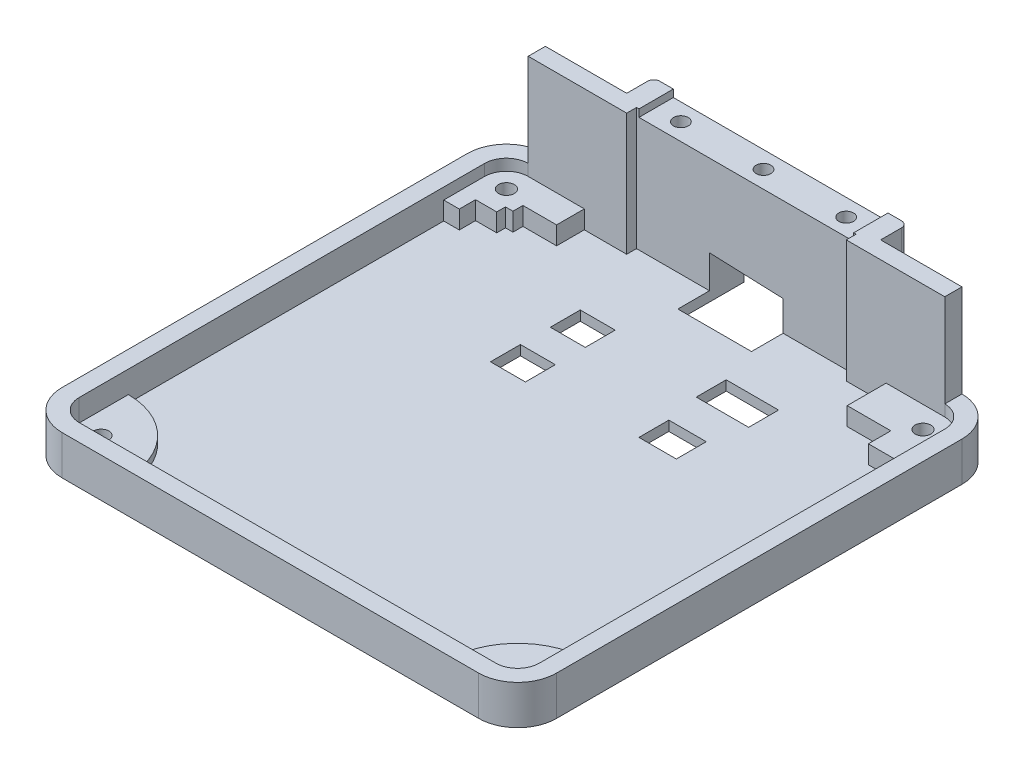
from build123d import *
from build123d.topology import SkipClean

# Parameters (mm, degrees)
SKETCH2_R             = 1.6
BOSS_EXTRUDE1_DEPTH   = 1.5
BOSS_EXTRUDE1_2_DEPTH = 1.5
BOSS_EXTRUDE3_START   = 2
SKETCH5_R             = 1.6
SKETCH5_W             = 7.112
SKETCH5_H             = 6.096
SKETCH5_W_2           = 7.62
BOSS_EXTRUDE3_DEPTH   = 2
SKETCH6_R             = 1.6
BOSS_EXTRUDE4_DEPTH   = 3.7
SKETCH7_W             = 15
SKETCH7_H             = 3.5
CUT_EXTRUDE1_DEPTH    = 18.7
BOSS_EXTRUDE5_DEPTH   = 14
SKETCH10_W            = 8.676175164
SKETCH10_H            = 12.620836119
BOSS_EXTRUDE6_DEPTH   = 20.2
BOSS_EXTRUDE9_START   = -25.9
BOSS_EXTRUDE9_DEPTH   = 25.9
BOSS_EXTRUDE10_DEPTH  = 9.9
SKETCH17_W            = 44.717081264
SKETCH17_H            = 2
CUT_EXTRUDE3_DEPTH    = 23.9
SKETCH18_W            = 4.640484925
SKETCH18_H            = 8.524085484
BOSS_EXTRUDE11_DEPTH  = 19.7
CUT_EXTRUDE4_DEPTH    = 0.5
BOSS_EXTRUDE12_START  = 1.5
BOSS_EXTRUDE12_DEPTH  = 1.5
SKETCH22_R            = 1.5
CUT_EXTRUDE5_DEPTH    = 8
BOSS_EXTRUDE13_START  = 5
SKETCH24_R            = 1.5
SKETCH24_R_2          = 0.75
BOSS_EXTRUDE13_DEPTH  = 5
SKETCH25_W            = 4.640484925
SKETCH25_H            = 19.7
CUT_EXTRUDE6_DEPTH    = 8.524085484
SKETCH26_W            = 8.676175164
SKETCH26_H            = 12.620836119
CUT_EXTRUDE7_DEPTH    = 23.9
CUT_EXTRUDE12_DEPTH   = 38
CUT_EXTRUDE13_START   = -8
CUT_EXTRUDE13_DEPTH   = 8


with BuildPart() as part:
    # Sketch2 → Boss-Extrude1 (new body)
    with BuildSketch(Plane(origin=(0, 0, 0), x_dir=(1, 0, 0), z_dir=(0, 1, 0))):
        with BuildLine():
            ThreePointArc((46.858540632, -31.275), (36.647536427, -35.504536427), (32.418, -45.715540632))
            Line((32.418, -45.715540632), (42.418, -45.715540632))
            ThreePointArc((42.418, -45.715540632), (45.557936393, -44.414936393), (46.858540632, -41.275))
            Line((46.858540632, -41.275), (46.858540632, -31.275))
        make_face()
        with Locations(Location((42.418, -41.275, 0), (0, 0, 270))):
            Circle(SKETCH2_R, mode=Mode.SUBTRACT)
    extrude(amount=BOSS_EXTRUDE1_DEPTH)



with BuildPart() as body_2:
    # Sketch2 → Boss-Extrude1 2 (new body)
    with BuildSketch(Plane(origin=(0, 0, 0), x_dir=(1, 0, 0), z_dir=(0, 1, 0))):
        with BuildLine():
            Line((-46.858540632, -31.275), (-46.858540632, -41.275))
            ThreePointArc((-46.858540632, -41.275), (-45.557936393, -44.414936393), (-42.418, -45.715540632))
            Line((-42.418, -45.715540632), (-32.418, -45.715540632))
            ThreePointArc((-32.418, -45.715540632), (-36.647536427, -35.504536427), (-46.858540632, -31.275))
        make_face()
        with Locations(Location((-42.418, -41.275, 0), (0, 0, 270))):
            Circle(SKETCH2_R, mode=Mode.SUBTRACT)
    extrude(amount=BOSS_EXTRUDE1_2_DEPTH)


with BuildPart() as part_1:
    with SkipClean():  # the faces are left unmerged after this step: merging them gives an invalid solid
        add(part.part)

        add(body_2.part)  # Boss-Extrude3 merges body 2
        # Sketch5 → Boss-Extrude3 (add)
        with BuildSketch(Plane.XZ.offset(BOSS_EXTRUDE3_START)):
            with BuildLine():
                ThreePointArc((42.418, -49.215540632), (48.032810127, -46.889810127), (50.358540632, -41.275))
                Line((50.358540632, -41.275), (50.358540632, 41.275))
                ThreePointArc((50.358540632, 41.275), (48.032810127, 46.889810127), (42.418, 49.215540632))
                Line((42.418, 49.215540632), (-42.418, 49.215540632))
                ThreePointArc((-42.418, 49.215540632), (-48.032810127, 46.889810127), (-50.358540632, 41.275))
                Line((-50.358540632, 41.275), (-50.358540632, -41.275))
                ThreePointArc((-50.358540632, -41.275), (-48.032810127, -46.889810127), (-42.418, -49.215540632))
                Line((-42.418, -49.215540632), (42.418, -49.215540632))
            make_face()
            with Locations(Location((-42.418, -41.275, 0), (0, 0, 270))):
                Circle(SKETCH5_R, mode=Mode.SUBTRACT)
            with Locations((-13.714442552, -28.125314405)):
                Rectangle(SKETCH5_W, SKETCH5_H, mode=Mode.SUBTRACT)
            with Locations((-13.714442552, -15.933314405)):
                Rectangle(SKETCH5_W, SKETCH5_H, mode=Mode.SUBTRACT)
            Polygon((9.907557448, -33.713314405), (9.907557448, -31.173314405), (9.907557448, -27.617314405), (20.575557448, -27.617314405), (20.575557448, -33.713314405), align=None, mode=Mode.SUBTRACT)
            with Locations(Location((42.418, -41.275, 0), (0, 0, 270))):
                Circle(SKETCH5_R, mode=Mode.SUBTRACT)
            with Locations((14.987557448, -17.715314405)):
                Rectangle(SKETCH5_W_2, SKETCH5_H, mode=Mode.SUBTRACT)
            with Locations(Location((42.418, 41.275, 0), (0, 0, 270))):
                Circle(SKETCH5_R, mode=Mode.SUBTRACT)
            with Locations(Location((-42.418, 41.275, 0), (0, 0, 90))):
                Circle(SKETCH5_R, mode=Mode.SUBTRACT)
        extrude(amount=-BOSS_EXTRUDE3_DEPTH)

    # Sketch6 → Boss-Extrude4 (add)
    # profile 1 of 2: a face of its own
    with SkipClean():  # the faces are left unmerged after this step: merging them gives an invalid solid
        with BuildSketch(Plane(origin=(0, 0, 0), x_dir=(1, 0, 0), z_dir=(0, 1, 0))):
            with BuildLine():
                Line((-37.845181083, 38.037263731), (-39.369181083, 38.037263731))
                Line((-39.369181083, 38.037263731), (-39.369181083, 36.259263731))
                Line((-39.369181083, 36.259263731), (-43.687181083, 36.259263731))
                Line((-43.687181083, 36.259263731), (-43.687181083, 32.957263731))
                Line((-43.687181083, 32.957263731), (-46.858540632, 32.957263731))
                Line((-46.858540632, 32.957263731), (-46.858540632, 41.275))
                ThreePointArc((-46.858540632, 41.275), (-45.557936393, 44.414936393), (-42.418, 45.715540632))
                Line((-42.418, 45.715540632), (-30.987181083, 45.715540632))
                Line((-30.987181083, 45.715540632), (-30.987181083, 40.069263731))
                Line((-30.987181083, 40.069263731), (-37.845181083, 40.069263731))
                Line((-37.845181083, 40.069263731), (-37.845181083, 38.037263731))
            make_face()
            with Locations(Location((-42.418, 41.275, 0), (0, 0, 270))):
                Circle(SKETCH6_R, mode=Mode.SUBTRACT)
        # profile 2 of 2: a face of its own
        with BuildSketch(Plane(origin=(0, 0, 0), x_dir=(1, 0, 0), z_dir=(0, 1, 0))):
            with BuildLine():
                Line((39.37040836, 37.781480113), (39.37040836, 33.209480113))
                Line((39.37040836, 33.209480113), (46.858540632, 33.209480113))
                Line((46.858540632, 33.209480113), (46.858540632, 41.275))
                ThreePointArc((46.858540632, 41.275), (45.557936393, 44.414936393), (42.418, 45.715540632))
                Line((42.418, 45.715540632), (30.48040836, 45.715540632))
                Line((30.48040836, 45.715540632), (30.48040836, 37.781480113))
                Line((30.48040836, 37.781480113), (39.37040836, 37.781480113))
            make_face()
            with Locations(Location((42.418, 41.275, 0), (0, 0, 270))):
                Circle(SKETCH6_R, mode=Mode.SUBTRACT)
        extrude(amount=BOSS_EXTRUDE4_DEPTH)

    # Sketch7 → Cut-Extrude1 (cut)
    with SkipClean():  # the faces are left unmerged after this step: merging them gives an invalid solid
        with BuildSketch(Plane(origin=(0, 0, 0), x_dir=(1, 0, 0), z_dir=(0, 1, 0))):
            with Locations((0, 47.465540632)):
                Rectangle(SKETCH7_W, SKETCH7_H)
            Polygon((0, 41.275), (7.5, 41.275), (7.5, 45.715540632), (-7.5, 45.715540632), (-7.5, 41.275), align=None)
        extrude(amount=-CUT_EXTRUDE1_DEPTH, mode=Mode.SUBTRACT)

    # Sketch8 → Boss-Extrude5 (add)
    with SkipClean():  # the faces are left unmerged after this step: merging them gives an invalid solid
        with BuildSketch(Plane(origin=(0, 0, 0), x_dir=(1, 0, 0), z_dir=(0, 1, 0))):
            with BuildLine():
                Line((-42.418, 45.715540632), (-42.418, 49.215540632))
                ThreePointArc((-42.418, 49.215540632), (-48.032810127, 46.889810127), (-50.358540632, 41.275))
                Line((-50.358540632, 41.275), (-50.358540632, -41.275))
                Line((-50.358540632, -41.275), (-46.858540632, -41.275))
                Line((-46.858540632, -41.275), (-46.858540632, 41.275))
                ThreePointArc((-46.858540632, 41.275), (-45.557936393, 44.414936393), (-42.418, 45.715540632))
            make_face()
            with BuildLine():
                Line((-46.858540632, -41.275), (-50.358540632, -41.275))
                ThreePointArc((-50.358540632, -41.275), (-48.032810127, -46.889810127), (-42.418, -49.215540632))
                Line((-42.418, -49.215540632), (42.418, -49.215540632))
                Line((42.418, -49.215540632), (42.418, -45.715540632))
                Line((42.418, -45.715540632), (-42.418, -45.715540632))
                ThreePointArc((-42.418, -45.715540632), (-45.557936393, -44.414936393), (-46.858540632, -41.275))
            make_face()
            with BuildLine():
                Line((50.358540632, 41.275), (46.858540632, 41.275))
                Line((46.858540632, 41.275), (46.858540632, 33.209480113))
                Line((46.858540632, 33.209480113), (46.858540632, -31.275))
                Line((46.858540632, -31.275), (46.858540632, -41.275))
                ThreePointArc((46.858540632, -41.275), (45.557936393, -44.414936393), (42.418, -45.715540632))
                Line((42.418, -45.715540632), (42.418, -49.215540632))
                ThreePointArc((42.418, -49.215540632), (48.032810127, -46.889810127), (50.358540632, -41.275))
                Line((50.358540632, -41.275), (50.358540632, 41.275))
            make_face()
            with BuildLine():
                ThreePointArc((42.418, 45.715540632), (43.976739215, 45.432972242), (45.337101489, 44.621228862))
                Line((45.337101489, 44.621228862), (47.63791485, 47.258700735))
                ThreePointArc((47.63791485, 47.258700735), (45.205325484, 48.710254009), (42.418, 49.215540632))
                Line((42.418, 49.215540632), (-42.418, 49.215540632))
                Line((-42.418, 49.215540632), (-42.418, 45.715540632))
                Line((-42.418, 45.715540632), (-30.987181083, 45.715540632))
                Line((-30.987181083, 45.715540632), (-16.875382857, 45.715540632))
                Line((-16.875382857, 45.715540632), (22.418, 45.715540632))
                Line((22.418, 45.715540632), (30.48040836, 45.715540632))
                Line((30.48040836, 45.715540632), (42.418, 45.715540632))
            make_face()
            with BuildLine():
                Line((47.63791485, 47.258700735), (45.337101489, 44.621228862))
                ThreePointArc((45.337101489, 44.621228862), (46.460325437, 43.1129353), (46.858540632, 41.275))
                Line((46.858540632, 41.275), (50.358540632, 41.275))
                ThreePointArc((50.358540632, 41.275), (49.646455281, 44.561581778), (47.63791485, 47.258700735))
            make_face()
        extrude(amount=BOSS_EXTRUDE5_DEPTH)

    # Sketch13 → Boss-Extrude9 (add)
    with SkipClean():  # the faces are left unmerged after this step: merging them gives an invalid solid
        with BuildSketch(Plane.XZ.offset(2).offset(BOSS_EXTRUDE9_START)):
            with BuildLine():
                Line((25.858540632, -53.433909126), (25.858540632, -49.215540632))
                Line((25.858540632, -49.215540632), (7.5, -49.215540632))
                Line((7.5, -49.215540632), (-7.5, -49.215540632))
                Line((-7.5, -49.215540632), (-21.418, -49.215540632))
                Line((-21.418, -49.215540632), (-25.858540632, -49.215540632))
                Line((-25.858540632, -49.215540632), (-25.858540632, -53.433909125))
                ThreePointArc((-25.858540632, -53.433909125), (-25.483159455, -54.340159455), (-24.576909125, -54.715540632))
                Line((-24.576909125, -54.715540632), (-20.136368493, -54.715540632))
                Line((-20.136368493, -54.715540632), (24.576909126, -54.715540632))
                ThreePointArc((24.576909126, -54.715540632), (25.483159455, -54.340159455), (25.858540632, -53.433909126))
            make_face()
        extrude(amount=BOSS_EXTRUDE9_DEPTH)

    # Sketch16 → Boss-Extrude10 (add)
    with SkipClean():  # the faces are left unmerged after this step: merging them gives an invalid solid
        with BuildSketch(Plane(origin=(0, 14, 0), x_dir=(1, 0, 0), z_dir=(0, 1, 0))):
            Polygon((-42.418, 45.715540632), (-42.418, 49.215540632), (-25.858540632, 49.215540632), (25.858540632, 49.215540632), (42.418, 49.215540632), (42.418, 45.715540632), align=None)
        extrude(amount=BOSS_EXTRUDE10_DEPTH)

    # Sketch17 → Cut-Extrude3 (cut)
    with SkipClean():  # the faces are left unmerged after this step: merging them gives an invalid solid
        with BuildSketch(Plane(origin=(0, 23.9, 0), x_dir=(1, 0, 0), z_dir=(0, 1, 0))):
            with Locations((0, 46.715540632)):
                Rectangle(SKETCH17_W, SKETCH17_H)
        extrude(amount=-CUT_EXTRUDE3_DEPTH, mode=Mode.SUBTRACT)

    # Sketch18 → Boss-Extrude11 (add)
    with SkipClean():  # the faces are left unmerged after this step: merging them gives an invalid solid
        with BuildSketch(Plane(origin=(0, 3.7, 0), x_dir=(1, 0, 0), z_dir=(0, 1, 0))):
            with Locations((8.052606194, 43.45349789)):
                Rectangle(SKETCH18_W, SKETCH18_H)
        extrude(amount=BOSS_EXTRUDE11_DEPTH)

    # Sketch19 → Cut-Extrude4 (cut)
    with SkipClean():  # the faces are left unmerged after this step: merging them gives an invalid solid
        with BuildSketch(Plane(origin=(0, 23.9, 0), x_dir=(1, 0, 0), z_dir=(0, 1, 0))):
            with BuildLine():
                Line((22.358540632, 47.715540632), (22.358540632, 45.715540632))
                Line((22.358540632, 45.715540632), (42.418, 45.715540632))
                Line((42.418, 45.715540632), (42.418, 49.215540632))
                Line((42.418, 49.215540632), (25.858540632, 49.215540632))
                Line((25.858540632, 49.215540632), (25.858540632, 53.433909126))
                ThreePointArc((25.858540632, 53.433909126), (25.483159455, 54.340159455), (24.576909126, 54.715540632))
                Line((24.576909126, 54.715540632), (-24.576909125, 54.715540632))
                ThreePointArc((-24.576909125, 54.715540632), (-25.483159455, 54.340159455), (-25.858540632, 53.433909125))
                Line((-25.858540632, 53.433909125), (-25.858540632, 49.215540632))
                Line((-25.858540632, 49.215540632), (-42.418, 49.215540632))
                Line((-42.418, 49.215540632), (-42.418, 45.715540632))
                Line((-42.418, 45.715540632), (-22.358540632, 45.715540632))
                Line((-22.358540632, 45.715540632), (-22.358540632, 47.715540632))
                Line((-22.358540632, 47.715540632), (22.358540632, 47.715540632))
            make_face()
        extrude(amount=-CUT_EXTRUDE4_DEPTH, mode=Mode.SUBTRACT)

    # Sketch20 → Boss-Extrude12 (add)
    with SkipClean():  # the faces are left unmerged after this step: merging them gives an invalid solid
        with BuildSketch(Plane(origin=(0, 23.4, 0), x_dir=(1, 0, 0), z_dir=(0, 1, 0)).offset(BOSS_EXTRUDE12_START)):
            Polygon((-22.358540632, 45.715540632), (-22.358540632, 47.715540632), (-42.418, 47.715540632), (-42.418, 45.715540632), (-30.987181083, 45.715540632), align=None)
            Polygon((-21.858540632, 47.715540632), (-21.858540632, 51.215540632), (-25.858540632, 51.215540632), (-25.858540632, 49.215540632), (-42.418, 49.215540632), (-42.418, 47.715540632), (-22.358540632, 47.715540632), align=None)
            with BuildLine():
                Line((-21.858540632, 51.215540632), (-21.858540632, 54.715540632))
                Line((-21.858540632, 54.715540632), (-24.576909125, 54.715540632))
                ThreePointArc((-24.576909125, 54.715540632), (-25.483159455, 54.340159455), (-25.858540632, 53.433909125))
                Line((-25.858540632, 53.433909125), (-25.858540632, 51.215540632))
                Line((-25.858540632, 51.215540632), (-21.858540632, 51.215540632))
            make_face()
            Polygon((25.858540632, 51.215540632), (21.858540632, 51.215540632), (21.858540632, 47.715540632), (22.358540632, 47.715540632), (22.358540632, 45.715540632), (30.48040836, 45.715540632), (42.418, 45.715540632), (42.418, 49.215540632), (25.858540632, 49.215540632), align=None)
            with BuildLine():
                Line((24.576909126, 54.715540632), (21.858540632, 54.715540632))
                Line((21.858540632, 54.715540632), (21.858540632, 51.215540632))
                Line((21.858540632, 51.215540632), (25.858540632, 51.215540632))
                Line((25.858540632, 51.215540632), (25.858540632, 53.433909126))
                ThreePointArc((25.858540632, 53.433909126), (25.483159455, 54.340159455), (24.576909126, 54.715540632))
            make_face()
        extrude(amount=-BOSS_EXTRUDE12_DEPTH)

    # Sketch22 → Cut-Extrude5 (cut)
    with SkipClean():  # the faces are left unmerged after this step: merging them gives an invalid solid
        with BuildSketch(Plane(origin=(0, 23.4, 0), x_dir=(1, 0, 0), z_dir=(0, 1, 0))):
            with Locations(Location((-16.829540632, 51.215540632, 0), (0, 0, 270))):
                Circle(SKETCH22_R)
            with Locations(Location((0, 51.215540632, 0), (0, 0, 270))):
                Circle(SKETCH22_R)
            with Locations(Location((16.84, 51.215540632, 0), (0, 0, 270))):
                Circle(SKETCH22_R)
        extrude(amount=-CUT_EXTRUDE5_DEPTH, mode=Mode.SUBTRACT)

    # Sketch24 → Boss-Extrude13 (add)
    # profile 1 of 3: a face of its own
    with SkipClean():  # the faces are left unmerged after this step: merging them gives an invalid solid
        with BuildSketch(Plane(origin=(0, 15.4, 0), x_dir=(1, 0, 0), z_dir=(0, 1, 0)).offset(BOSS_EXTRUDE13_START)):
            with Locations(Location((16.84, 51.215540632, 0), (0, 0, 270))):
                Circle(SKETCH24_R)
            with Locations(Location((16.84, 51.215540632, 0), (0, 0, 270))):
                Circle(SKETCH24_R_2, mode=Mode.SUBTRACT)
        # profile 2 of 3: a face of its own
        with BuildSketch(Plane(origin=(0, 15.4, 0), x_dir=(1, 0, 0), z_dir=(0, 1, 0)).offset(BOSS_EXTRUDE13_START)):
            with Locations(Location((0, 51.215540632, 0), (0, 0, 270))):
                Circle(SKETCH24_R)
            with Locations(Location((0, 51.215540632, 0), (0, 0, 270))):
                Circle(SKETCH24_R_2, mode=Mode.SUBTRACT)
        # profile 3 of 3: a face of its own
        with BuildSketch(Plane(origin=(0, 15.4, 0), x_dir=(1, 0, 0), z_dir=(0, 1, 0)).offset(BOSS_EXTRUDE13_START)):
            with Locations(Location((-16.829540632, 51.215540632, 0), (0, 0, 270))):
                Circle(SKETCH24_R)
            with Locations(Location((-16.829540632, 51.215540632, 0), (0, 0, 270))):
                Circle(SKETCH24_R_2, mode=Mode.SUBTRACT)
        extrude(amount=-BOSS_EXTRUDE13_DEPTH)

    # Sketch25 → Cut-Extrude6 (cut)
    with SkipClean():  # the faces are left unmerged after this step: merging them gives an invalid solid
        with BuildSketch(Plane.XY.offset(-39.191455148)):
            with Locations((8.052606194, 13.55)):
                Rectangle(SKETCH25_W, SKETCH25_H)
        extrude(amount=-CUT_EXTRUDE6_DEPTH, mode=Mode.SUBTRACT)

    # Sketch27 → Cut-Extrude12 (cut)
    with SkipClean():  # the faces are left unmerged after this step: merging them gives an invalid solid
        with BuildSketch(Plane(origin=(0, 0, -41.275), x_dir=(-1, 0, 0), z_dir=(0, 0, -1))):
            Polygon((-7.5, -2), (7.5, -2), (7.5, 0), (7.5, 6.7), (-7.5, 6.127563086), align=None)
        extrude(amount=CUT_EXTRUDE12_DEPTH, mode=Mode.SUBTRACT)

    # Sketch28 → Cut-Extrude13 (cut)
    with SkipClean():  # the faces are left unmerged after this step: merging them gives an invalid solid
        with BuildSketch(Plane(origin=(0, 14, 0), x_dir=(1, 0, 0), z_dir=(0, 1, 0)).offset(CUT_EXTRUDE13_START)):
            with BuildLine():
                Line((-42.418, 45.715540632), (-42.418, 49.215540632))
                ThreePointArc((-42.418, 49.215540632), (-48.032810127, 46.889810127), (-50.358540632, 41.275))
                Line((-50.358540632, 41.275), (-50.358540632, -41.275))
                ThreePointArc((-50.358540632, -41.275), (-48.032810127, -46.889810127), (-42.418, -49.215540632))
                Line((-42.418, -49.215540632), (42.418, -49.215540632))
                ThreePointArc((42.418, -49.215540632), (48.032810127, -46.889810127), (50.358540632, -41.275))
                Line((50.358540632, -41.275), (50.358540632, 41.275))
                ThreePointArc((50.358540632, 41.275), (48.032810127, 46.889810127), (42.418, 49.215540632))
                Line((42.418, 49.215540632), (42.418, 45.715540632))
                ThreePointArc((42.418, 45.715540632), (45.557936393, 44.414936393), (46.858540632, 41.275))
                Line((46.858540632, 41.275), (46.858540632, -41.275))
                ThreePointArc((46.858540632, -41.275), (45.557936393, -44.414936393), (42.418, -45.715540632))
                Line((42.418, -45.715540632), (-42.418, -45.715540632))
                ThreePointArc((-42.418, -45.715540632), (-45.557936393, -44.414936393), (-46.858540632, -41.275))
                Line((-46.858540632, -41.275), (-46.858540632, 41.275))
                ThreePointArc((-46.858540632, 41.275), (-45.557936393, 44.414936393), (-42.418, 45.715540632))
            make_face()
        extrude(amount=CUT_EXTRUDE13_DEPTH, mode=Mode.SUBTRACT)


with BuildPart() as body_2_2:
    # Sketch10 → Boss-Extrude6 (new body)
    with BuildSketch(Plane(origin=(0, 3.7, 0), x_dir=(1, 0, 0), z_dir=(0, 1, 0))):
        with Locations((2.035439785, 19.311208485)):
            Rectangle(SKETCH10_W, SKETCH10_H)
    extrude(amount=BOSS_EXTRUDE6_DEPTH)

    # Sketch26 → Cut-Extrude7 (cut)
    with BuildSketch(Plane(origin=(0, 23.9, 0), x_dir=(1, 0, 0), z_dir=(0, 1, 0))):
        with Locations((2.035439785, 19.311208485)):
            Rectangle(SKETCH26_W, SKETCH26_H)
    extrude(amount=-CUT_EXTRUDE7_DEPTH, mode=Mode.SUBTRACT)


solid = part_1.part
